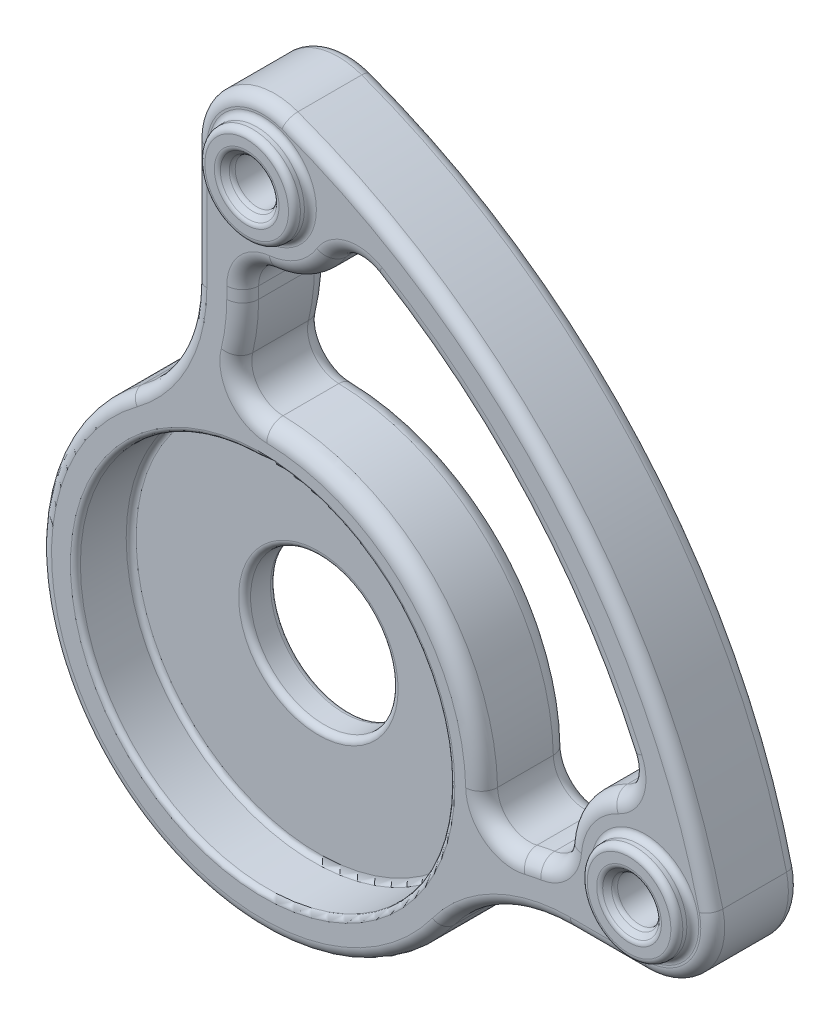
from build123d import *

# Parameters (mm, degrees)
SKETCH1_R           = 4.63
SKETCH1_R_2         = 1.375
BOSS_EXTRUDE1_DEPTH = 5.5
SKETCH2_R           = 3
SKETCH2_R_2         = 1.375
BOSS_EXTRUDE2_DEPTH = 1
CUT_EXTRUDE1_START  = -3.5
SKETCH3_R           = 4.63
CUT_EXTRUDE1_DEPTH  = 3.5
CUT_EXTRUDE2_DEPTH  = 43.48382045
FILLET1_R           = 2
FILLET2_R           = 1
FILLET3_R           = 0.75
CHAMFER1_SIZE       = 0.5
FILLET4_R           = 0.375
FILLET5_R           = 0.3125


with BuildPart() as part:
    # Sketch1 → Boss-Extrude1 (new body)
    with BuildSketch(Plane.XY):
        with BuildLine():
            Line((-4.25, 27), (-4.25, 19.311589784))
            ThreePointArc((-4.25, 19.311589784), (-5.323214464, 14.80465069), (-8.3125, 11.265094041))
            ThreePointArc((-8.3125, 11.265094041), (-9.899494937, -9.899494937), (11.265094041, -8.3125))
            ThreePointArc((11.265094041, -8.3125), (14.80465069, -5.323214464), (19.311589784, -4.25))
            Line((19.311589784, -4.25), (24, -4.25))
            ThreePointArc((24, -4.25), (27.336565295, -2.632457413), (28.133348727, 0.988902572))
            ThreePointArc((28.133348727, 0.988902572), (18.564757498, 19.335339998), (1.466682061, 30.988902572))
            ThreePointArc((1.466682061, 30.988902572), (-2.431984914, 30.48539085), (-4.25, 27))
        make_face()
        Circle(SKETCH1_R, mode=Mode.SUBTRACT)
        with Locations((0, 27)):
            Circle(SKETCH1_R_2, mode=Mode.SUBTRACT)
        with Locations((24, 0)):
            Circle(SKETCH1_R_2, mode=Mode.SUBTRACT)
    extrude(amount=BOSS_EXTRUDE1_DEPTH)

    # Sketch2 → Boss-Extrude2 (add)
    # profile 1 of 2: a face of its own
    with BuildSketch(Plane.XY.offset(5.5)):
        with Locations((0, 27)):
            Circle(SKETCH2_R)
        with Locations((0, 27)):
            Circle(SKETCH2_R_2, mode=Mode.SUBTRACT)
    # profile 2 of 2: a face of its own
    with BuildSketch(Plane.XY.offset(5.5)):
        with Locations((24, 0)):
            Circle(SKETCH2_R)
        with Locations((24, 0)):
            Circle(SKETCH2_R_2, mode=Mode.SUBTRACT)
    extrude(amount=BOSS_EXTRUDE2_DEPTH)

    # Sketch3 → Cut-Extrude1 (cut)
    with BuildSketch(Plane.XY.offset(5.5).offset(CUT_EXTRUDE1_START)):
        with BuildLine():
            ThreePointArc((11.75, 0), (6.610075543, 9.714391453), (-4.312876819, 10.929848743))
            ThreePointArc((-4.312876819, 10.929848743), (-8.308504679, -8.308504679), (10.929848743, -4.312876819))
            ThreePointArc((10.929848743, -4.312876819), (11.543141313, -2.195082831), (11.75, 0))
        make_face()
        Circle(SKETCH3_R, mode=Mode.SUBTRACT)
    extrude(amount=CUT_EXTRUDE1_DEPTH, mode=Mode.SUBTRACT)

    # Sketch3<3> → Cut-Extrude2 (cut, through all)
    with BuildSketch(Plane.XY.offset(5.5)):
        with BuildLine():
            Line((-1.25, 22.158770817), (-1.25, 19.311589784))
            ThreePointArc((-1.25, 19.311589784), (-1.597793083, 16.324674965), (-2.622563098, 13.497579887))
            ThreePointArc((-2.622563098, 13.497579887), (9.722718241, 9.722718241), (13.497579887, -2.622563098))
            ThreePointArc((13.497579887, -2.622563098), (16.250472413, -1.615540754), (19.159002131, -1.250895531))
            ThreePointArc((19.159002131, -1.250895531), (19.979035121, 2.971841422), (23.77521928, 4.994944807))
            ThreePointArc((23.77521928, 4.994944807), (16.322529542, 17.342248481), (4.93414331, 26.191155273))
            ThreePointArc((4.93414331, 26.191155273), (2.730981341, 22.811713845), (-1.25, 22.158770817))
        make_face()
    extrude(amount=-CUT_EXTRUDE2_DEPTH, mode=Mode.SUBTRACT)

    # Fillet1
    fillet1_edges = [part.edges().sort_by_distance(p)[0] for p in [
        (23.77521928, 4.994944807, 2.75),
        (4.93414331, 26.191155273, 2.75),
        (-1.25, 22.158770817, 2.75),
        (-2.622563098, 13.497579887, 2.75),
        (19.159002131, -1.250895531, 2.75),
        (13.497579887, -2.622563098, 2.75),
    ]]
    fillet(fillet1_edges, radius=FILLET1_R)

    # Fillet2
    fillet2_edges = [part.edges().sort_by_distance(p)[0] for p in [
        (-0.738047618, 21.376600756, 0),
        (-1.265545865, 14.528021203, 0),
        (9.722718241, 9.722718241, 0),
        (19.900638802, 2.86273257, 0),
        (22.930555235, 5.648940441, 0),
        (16.322529542, 17.342248481, 0),
        (5.484599052, 25.275641147, 0),
        (-0.738047618, 21.376600756, 5.5),
        (-1.265545865, 14.528021203, 5.5),
        (9.722718241, 9.722718241, 5.5),
        (19.900638802, 2.86273257, 5.5),
        (22.930555235, 5.648940441, 5.5),
        (16.322529542, 17.342248481, 5.5),
        (5.484599052, 25.275641147, 5.5),
        (2.670516536, 22.772903901, 0),
        (2.670516536, 22.772903901, 5.5),
        (-1.343450694, 17.755638299, 0),
        (-1.343450694, 17.755638299, 5.5),
        (-1.25, 19.675942165, 0),
        (-1.25, 19.675942165, 5.5),
        (14.528021203, -1.265545865, 0),
        (16.772975007, -1.500277061, 0),
        (18.487108352, -0.788672851, 0),
        (14.528021203, -1.265545865, 5.5),
        (16.772975007, -1.500277061, 5.5),
        (18.487108352, -0.788672851, 5.5),
    ]]
    fillet(fillet2_edges, radius=FILLET2_R)

    # Fillet3
    fillet3_edges = [part.edges().sort_by_distance(p)[0] for p in [
        (27.336565295, -2.632457413, 0),
        (21.655794892, -4.25, 0),
        (14.80465069, -5.323214464, 0),
        (-9.899494937, -9.899494937, 0),
        (-5.323214464, 14.80465069, 0),
        (-4.25, 23.155794892, 0),
        (-2.431984914, 30.48539085, 0),
        (27.336565295, -2.632457413, 5.5),
        (21.655794892, -4.25, 5.5),
        (14.80465069, -5.323214464, 5.5),
        (-9.899494937, -9.899494937, 5.5),
        (-5.323214464, 14.80465069, 5.5),
        (-4.25, 23.155794892, 5.5),
        (-2.431984914, 30.48539085, 5.5),
        (18.564757498, 19.335339998, 0),
        (18.564757498, 19.335339998, 5.5),
    ]]
    fillet(fillet3_edges, radius=FILLET3_R)

    # Chamfer1
    chamfer1_edges = [part.edges().sort_by_distance(p)[0] for p in [
        (22.625, 0, 6.5),
        (-1.375, 27, 6.5),
    ]]
    chamfer(chamfer1_edges, length=CHAMFER1_SIZE)

    # Fillet4
    fillet4_edges = [part.edges().sort_by_distance(p)[0] for p in [
        (-4.63, 0, 0),
        (-1.375, 27, 0),
        (22.625, 0, 0),
        (21, 0, 6.5),
        (21, 0, 5.5),
        (-3, 27, 5.5),
        (-3, 27, 6.5),
        (-4.63, 0, 2),
        (22.625, 0, 6),
        (22.125, 0, 6.5),
        (-1.375, 27, 6),
        (-1.875, 27, 6.5),
    ]]
    fillet(fillet4_edges, radius=FILLET4_R)

    # Fillet5
    fillet5_edges = [part.edges().sort_by_distance(p)[0] for p in [
        (-10.929848743, 4.312876819, 5.5),
        (-10.929848743, 4.312876819, 2),
    ]]
    fillet(fillet5_edges, radius=FILLET5_R)


solid = part.part
